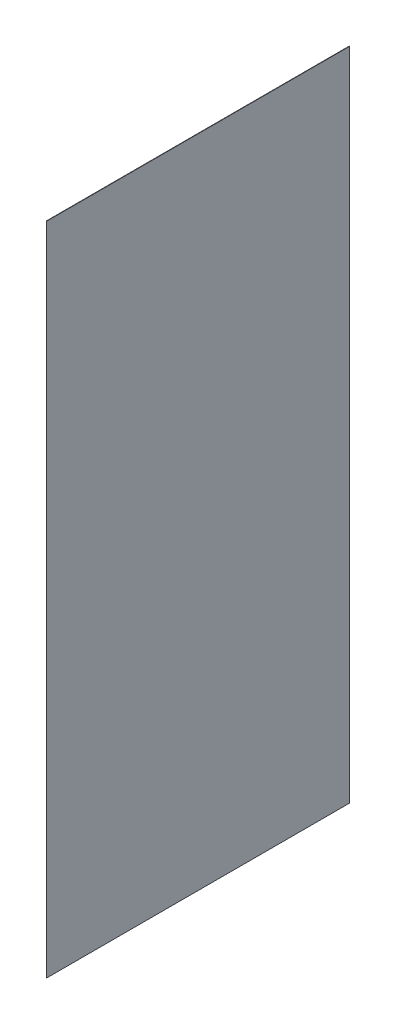
from build123d import *

# Parameters (mm, degrees)
SKETCH1_W                  = 1
SKETCH1_H                  = 1727
TOPPING_IC_YAN_SAG_1_DEPTH = 798.5


with BuildPart() as part:
    # Sketch1 → TOPPING_ic_yan_sag_1 (new body)
    with BuildSketch(Plane.XY):
        with Locations((658, 1105)):
            Rectangle(SKETCH1_W, SKETCH1_H)
    extrude(amount=-TOPPING_IC_YAN_SAG_1_DEPTH)


solid = part.part
